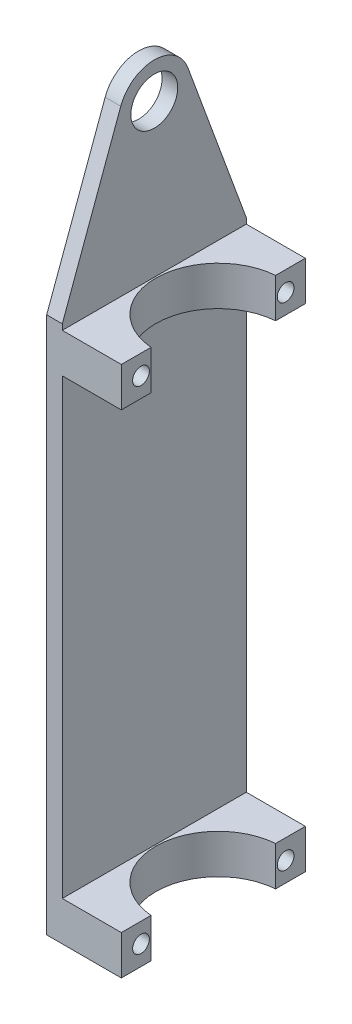
from build123d import *

# Parameters (mm, degrees)
SKETCH1_R                      = 4.7625
BOSS_EXTRUDE1_DEPTH            = 3.175
SKETCH2_W                      = 37.4
SKETCH2_H                      = 8
BOSS_EXTRUDE2_DEPTH            = 12
CUT_EXTRUDE1_DEPTH             = 107.751911575
CUT_EXTRUDE1_DEPTH_BACK        = 107.751911575
SKETCH3_R                      = 12.7
CBORE_FOR_M3_SHCS1_D           = 3.4
CBORE_FOR_M3_SHCS1_CBORE_D     = 6.5
CBORE_FOR_M3_SHCS1_CBORE_DEPTH = 3


with BuildPart() as part:
    # Sketch1 → Boss-Extrude1 (new body)
    with BuildSketch(Plane(origin=(0, 0, 0), x_dir=(0, 0, -1), z_dir=(1, 0, 0))):
        with BuildLine():
            Line((-18.7, -104), (18.7, -104))
            Line((18.7, -104), (18.7, 5.15))
            Line((18.7, 5.15), (6.817247269, 37.503806287))
            ThreePointArc((6.817247269, 37.503806287), (0, 42.2625), (-6.817247269, 37.503806287))
            Line((-6.817247269, 37.503806287), (-18.7, 5.15))
            Line((-18.7, 5.15), (-18.7, -104))
        make_face()
        with Locations((0, 35)):
            Circle(SKETCH1_R, mode=Mode.SUBTRACT)
    extrude(amount=BOSS_EXTRUDE1_DEPTH)

    # Sketch2 → Boss-Extrude2 (add)
    with BuildSketch(Plane(origin=(3.175, 0, 0), x_dir=(0, 0, -1), z_dir=(1, 0, 0))):
        Rectangle(SKETCH2_W, SKETCH2_H)
        with Locations((0, -100)):
            Rectangle(SKETCH2_W, SKETCH2_H)
    extrude(amount=BOSS_EXTRUDE2_DEPTH)

    # Sketch3 → Cut-Extrude1 (cut, two sides: drawn at the far end of the back side and taken through both)
    with BuildSketch(Plane(origin=(0, 0, 0), x_dir=(1, 0, 0), z_dir=(0, 1, 0)).offset(-CUT_EXTRUDE1_DEPTH_BACK)):
        with Locations((16.175, 0)):
            Circle(SKETCH3_R)
    extrude(amount=CUT_EXTRUDE1_DEPTH + CUT_EXTRUDE1_DEPTH_BACK, mode=Mode.SUBTRACT)

    # CBORE for M3 SHCS1 (through all)
    with Locations(Plane.ZY):
        with Locations((-14.7, 0), (14.7, 0), (14.7, -100), (-14.7, -100)):
            CounterBoreHole(CBORE_FOR_M3_SHCS1_D / 2, CBORE_FOR_M3_SHCS1_CBORE_D / 2, CBORE_FOR_M3_SHCS1_CBORE_DEPTH)


solid = part.part
